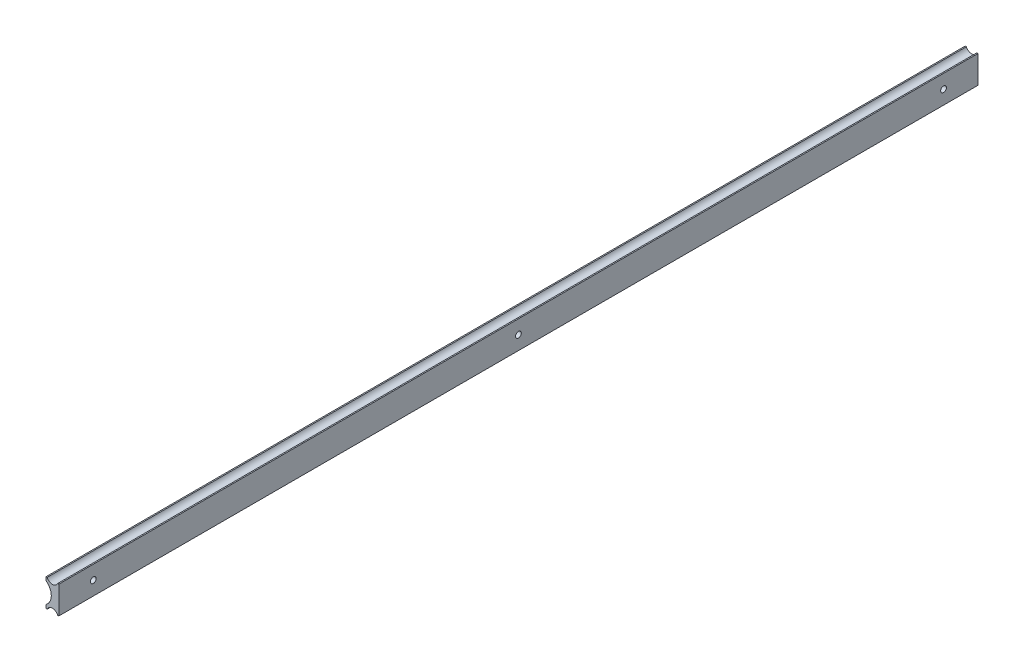
from build123d import *

# Parameters (mm, degrees)
SKETCH_1_W          = 5.6
SKETCH_1_H          = 12
EXTRUDE_1_DEPTH     = 200
SKETCH_2_R          = 2.5
CUT_EXTRUDE_1_DEPTH = 230
SKETCH_3_R          = 5.5
CUT_EXTRUDE_2_DEPTH = 690
HOLE_WIZARD_M3_1_D  = 2.5


with BuildPart() as part:
    # 草图1 → 凸台-拉伸1 (new, symmetric)
    with BuildSketch(Plane.XY):
        Rectangle(SKETCH_1_W, SKETCH_1_H)
    extrude(amount=EXTRUDE_1_DEPTH, both=True)

    # 草图2 → 切除-拉伸1 (cut, symmetric)
    with BuildSketch(Plane.XY):
        with Locations((0, 7)):
            Circle(SKETCH_2_R)
    cut_extrude_1 = extrude(amount=CUT_EXTRUDE_1_DEPTH, both=True, mode=Mode.SUBTRACT)

    # 镜向1: 切除-拉伸1 across plane
    add(cut_extrude_1.mirror(Plane.ZX), mode=Mode.SUBTRACT)

    # 草图3 → 切除-拉伸2 (cut, symmetric)
    with BuildSketch(Plane.XY.offset(200)):
        with Locations((-6, 0)):
            Circle(SKETCH_3_R)
    extrude(amount=CUT_EXTRUDE_2_DEPTH, both=True, mode=Mode.SUBTRACT)

    # M3 螺纹孔1 (through all)
    with Locations(Plane(origin=(2.8, 0, 0), x_dir=(0, 0, -1), z_dir=(1, 0, 0))):
        with Locations((-185, 0), (0, 0), (185, 0)):
            Hole(HOLE_WIZARD_M3_1_D / 2)


solid = part.part
